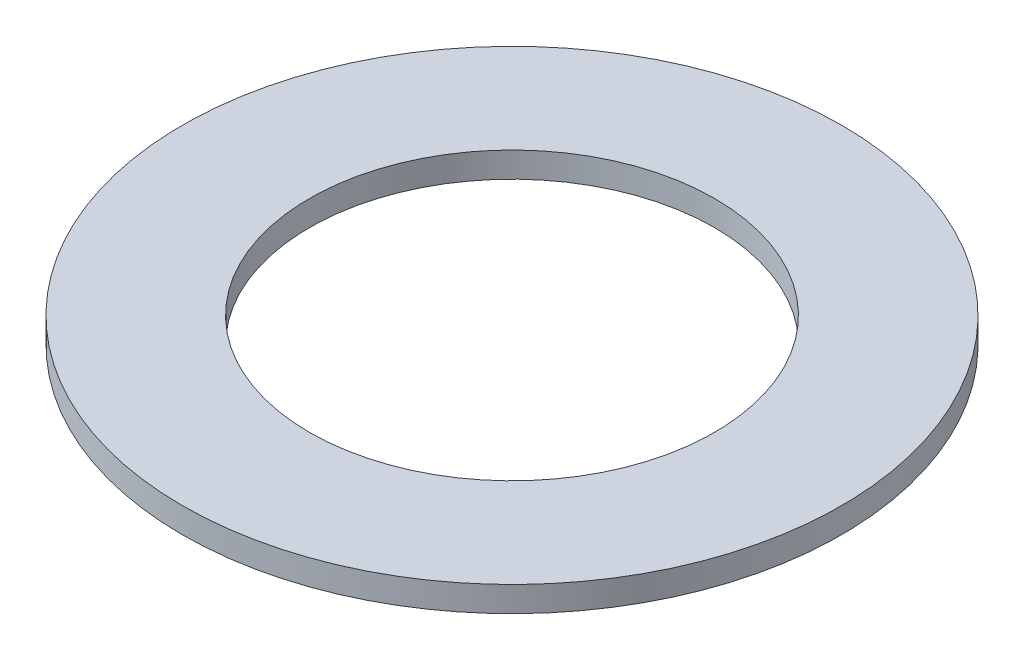
from build123d import *

# Parameters (mm, degrees)
SKETCH1_R           = 7.825
SKETCH1_R_2         = 4.81
BOSS_EXTRUDE1_DEPTH = 0.6


with BuildPart() as part:
    # Sketch1 → Boss-Extrude1 (new body)
    with BuildSketch(Plane(origin=(0, 0, 0), x_dir=(1, 0, 0), z_dir=(0, 1, 0))):
        with Locations(Location((0, 0, 0), (0, 0, 270))):
            Circle(SKETCH1_R)
        with Locations(Location((0, 0, 0), (0, 0, 270))):
            Circle(SKETCH1_R_2, mode=Mode.SUBTRACT)
    extrude(amount=BOSS_EXTRUDE1_DEPTH)


solid = part.part
